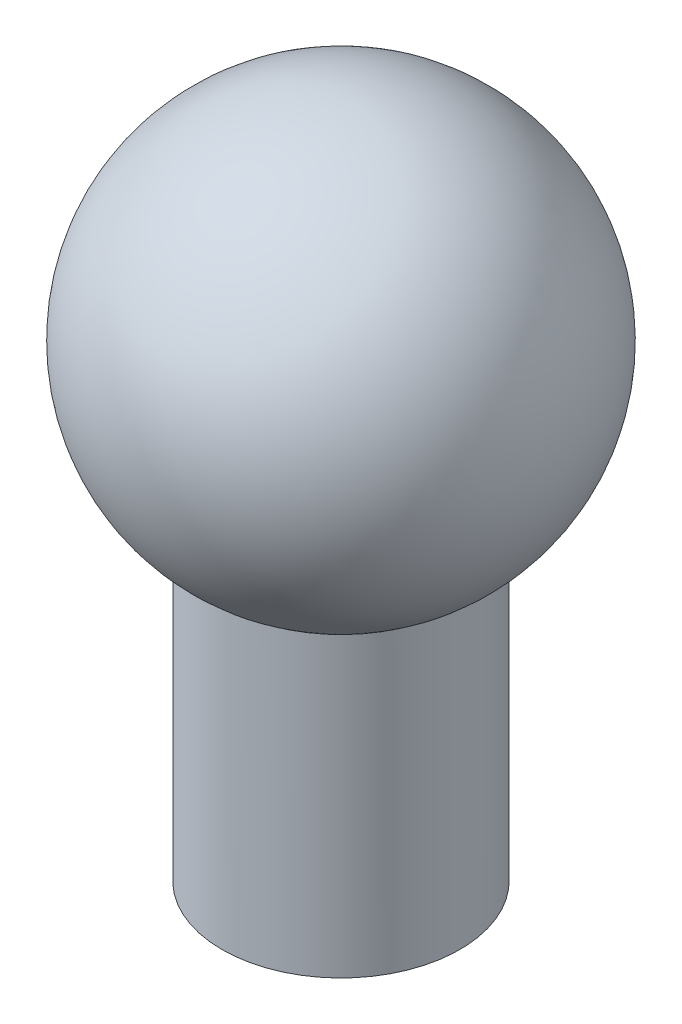
from build123d import *


with BuildPart() as part:
    # 草图1 → 旋转1 (revolve)
    with BuildSketch(Plane.XY):
        with BuildLine():
            Line((0, 0), (4, 0))
            Line((4, 0), (4, 10))
            ThreePointArc((4, 10), (6.678770041, 17.840756993), (0, 22.744562647))
            Line((0, 22.744562647), (0, 0))
        make_face()
    revolve(axis=Axis((0, 0, 0), (0, 1, 0)))


solid = part.part
